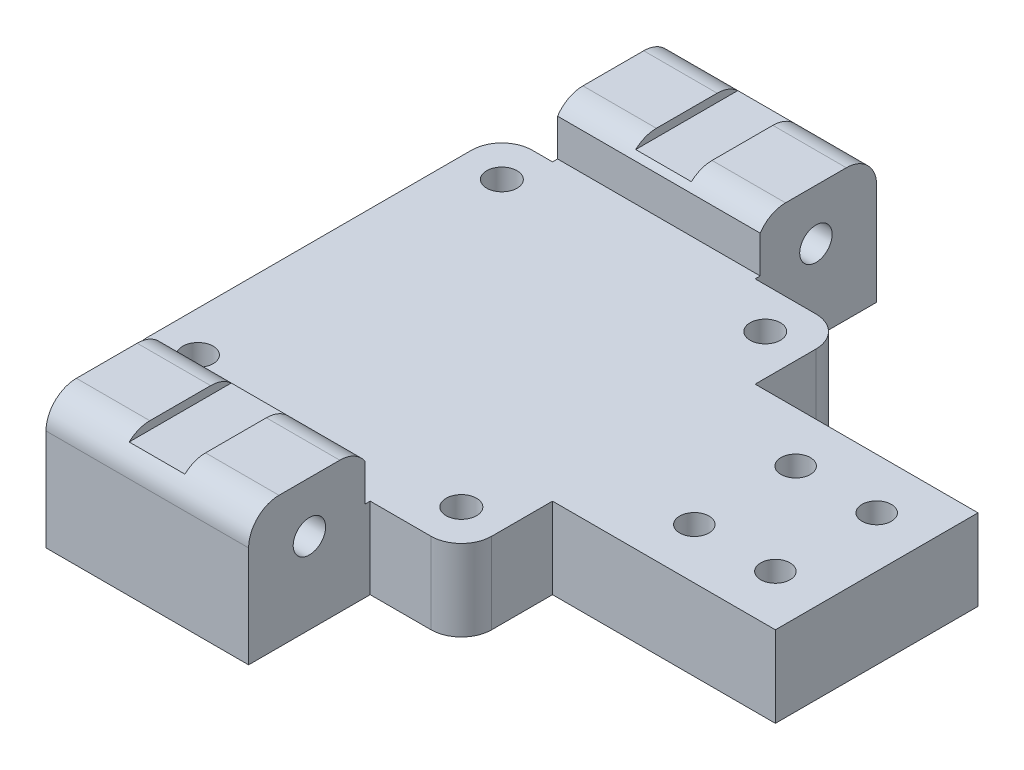
from build123d import *

# Parameters (mm, degrees)
SKETCH1_W            = 300
SKETCH1_H            = 20
BOSS_EXTRUDE1_DEPTH  = 8
SKETCH2_W            = 34
SKETCH2_H            = 8
BOSS_EXTRUDE2_DEPTH  = 9
SKETCH3_W            = 34
SKETCH3_H            = 8
BOSS_EXTRUDE3_DEPTH  = 9
SKETCH4_R            = 1.5
CUT_EXTRUDE1_DEPTH   = 302.504560496
SKETCH5_W            = 25
SKETCH5_H            = 8
BOSS_EXTRUDE4_DEPTH  = 17
SKETCH6_W            = 25
SKETCH6_H            = 8
BOSS_EXTRUDE5_DEPTH  = 17
SKETCH7_W            = 10
SKETCH7_H            = 38
CUT_EXTRUDE2_DEPTH   = 303.37890138
SKETCH8_W            = 7
SKETCH8_H            = 16
CUT_EXTRUDE3_DEPTH   = 4
CUT_EXTRUDE4_DEPTH   = 7
BOSS_EXTRUDE6_DEPTH  = 10
SKETCH12_W           = 8
SKETCH12_H           = 8
BOSS_EXTRUDE7_DEPTH  = 17
SKETCH13_R           = 1.7
CUT_EXTRUDE6_DEPTH   = 305.926220585
SKETCH14_W           = 20
SKETCH14_H           = 13
BOSS_EXTRUDE8_DEPTH  = 12
SKETCH15_R           = 1.6
CUT_EXTRUDE7_DEPTH   = 20
SKETCH16_W           = 20
SKETCH16_H           = 13
BOSS_EXTRUDE9_DEPTH  = 12
SKETCH17_R           = 1.6
CUT_EXTRUDE8_DEPTH   = 20
SKETCH18_W           = 20
SKETCH18_H           = 13
BOSS_EXTRUDE10_DEPTH = 12
CUT_EXTRUDE9_START   = -20
SKETCH19_R           = 1.6
CUT_EXTRUDE9_DEPTH   = 20
SKETCH20_W           = 20
SKETCH20_H           = 13
BOSS_EXTRUDE11_DEPTH = 12
CUT_EXTRUDE10_START  = -20
SKETCH21_R           = 1.6
CUT_EXTRUDE10_DEPTH  = 20
FILLET6_R            = 3
SKETCH22_W           = 123.750788161
SKETCH22_H           = 72.639217631
CUT_EXTRUDE11_DEPTH  = 244
SKETCH23_R           = 1.45
CUT_EXTRUDE12_DEPTH  = 71.611613776
FILLET7_R            = 3
SKETCH24_W           = 5.5
SKETCH24_H           = 78.243551934
CUT_EXTRUDE13_DEPTH  = 0.8
SKETCH25_W           = 20
SKETCH25_H           = 5.75655834
CUT_EXTRUDE14_DEPTH  = 0.5
SKETCH26_W           = 20
SKETCH26_H           = 21.459079842
CUT_EXTRUDE15_DEPTH  = 0.5


with BuildPart() as part:
    # Sketch1 → Boss-Extrude1 (new body)
    with BuildSketch(Plane(origin=(0, 0, 0), x_dir=(1, 0, 0), z_dir=(0, 1, 0))):
        with Locations((150, -10)):
            Rectangle(SKETCH1_W, SKETCH1_H)
    extrude(amount=BOSS_EXTRUDE1_DEPTH)

    # Sketch2 → Boss-Extrude2 (add)
    with BuildSketch(Plane.XY.offset(20)):
        with Locations((17, 4)):
            Rectangle(SKETCH2_W, SKETCH2_H)
        with Locations((283, 4)):
            Rectangle(SKETCH2_W, SKETCH2_H)
    extrude(amount=BOSS_EXTRUDE2_DEPTH)

    # Sketch3 → Boss-Extrude3 (add)
    with BuildSketch(Plane(origin=(0, 0, 0), x_dir=(-1, 0, 0), z_dir=(0, 0, -1))):
        with Locations((-17, 4)):
            Rectangle(SKETCH3_W, SKETCH3_H)
        with Locations((-283, 4)):
            Rectangle(SKETCH3_W, SKETCH3_H)
    extrude(amount=BOSS_EXTRUDE3_DEPTH)

    # Sketch4 → Cut-Extrude1 (cut, through all)
    with BuildSketch(Plane(origin=(0, 8, 0), x_dir=(1, 0, 0), z_dir=(0, 1, 0))):
        with Locations(Location((4, 5, 0), (0, 0, 270))):
            Circle(SKETCH4_R)
        with Locations(Location((30, 5, 0), (0, 0, 270))):
            Circle(SKETCH4_R)
        with Locations(Location((30, -25, 0), (0, 0, 270))):
            Circle(SKETCH4_R)
        with Locations(Location((4, -25, 0), (0, 0, 270))):
            Circle(SKETCH4_R)
        with Locations(Location((296, -25, 0), (0, 0, 270))):
            Circle(SKETCH4_R)
        with Locations(Location((296, 5, 0), (0, 0, 270))):
            Circle(SKETCH4_R)
        with Locations(Location((270, -25, 0), (0, 0, 270))):
            Circle(SKETCH4_R)
        with Locations(Location((270, 5, 0), (0, 0, 270))):
            Circle(SKETCH4_R)
    extrude(amount=-CUT_EXTRUDE1_DEPTH, mode=Mode.SUBTRACT)

    # Sketch5 → Boss-Extrude4 (add)
    with BuildSketch(Plane.XY.offset(20)):
        with Locations((253.5, 4)):
            Rectangle(SKETCH5_W, SKETCH5_H)
    extrude(amount=BOSS_EXTRUDE4_DEPTH)

    # Sketch6 → Boss-Extrude5 (add)
    with BuildSketch(Plane(origin=(0, 0, 0), x_dir=(-1, 0, 0), z_dir=(0, 0, -1))):
        with Locations((-253.5, 4)):
            Rectangle(SKETCH6_W, SKETCH6_H)
    extrude(amount=BOSS_EXTRUDE5_DEPTH)

    # Sketch7 → Cut-Extrude2 (cut, through all)
    with BuildSketch(Plane(origin=(0, 8, 0), x_dir=(1, 0, 0), z_dir=(0, 1, 0))):
        with Locations((254, -10)):
            Rectangle(SKETCH7_W, SKETCH7_H)
    extrude(amount=-CUT_EXTRUDE2_DEPTH, mode=Mode.SUBTRACT)

    # Sketch8 → Cut-Extrude3 (cut)
    with BuildSketch(Plane(origin=(0, 8, 0), x_dir=(1, 0, 0), z_dir=(0, 1, 0))):
        with Locations((262.5, -10)):
            Rectangle(SKETCH8_W, SKETCH8_H)
    extrude(amount=-CUT_EXTRUDE3_DEPTH, mode=Mode.SUBTRACT)

    # Sketch9 → Cut-Extrude4 (cut)
    with BuildSketch(Plane.ZY.offset(-259)):
        Polygon((18, 4), (22, 8), (18, 8), align=None)
        Polygon((2, 4), (-2, 8), (2, 8), align=None)
    extrude(amount=-CUT_EXTRUDE4_DEPTH, mode=Mode.SUBTRACT)

    # Sketch10 → Boss-Extrude6 (add)
    with BuildSketch(Plane.ZY.offset(-259)):
        Polygon((-2, 0), (-9, 8), (-9, 0), align=None)
        Polygon((29, 8), (22, 0), (29, 0), align=None)
    extrude(amount=BOSS_EXTRUDE6_DEPTH)

    # Sketch12 → Boss-Extrude7 (add)
    with BuildSketch(Plane.XY.offset(37)):
        with Locations((245, 4)):
            Rectangle(SKETCH12_W, SKETCH12_H)
    extrude(amount=BOSS_EXTRUDE7_DEPTH)

    # Sketch13 → Cut-Extrude6 (cut, through all)
    with BuildSketch(Plane(origin=(0, 8, 0), x_dir=(1, 0, 0), z_dir=(0, 1, 0))):
        with Locations(Location((245, -50, 0), (0, 0, 270))):
            Circle(SKETCH13_R)
        with Locations(Location((245, -18, 0), (0, 0, 270))):
            Circle(SKETCH13_R)
    extrude(amount=-CUT_EXTRUDE6_DEPTH, mode=Mode.SUBTRACT)

    # Sketch14 → Boss-Extrude8 (add)
    with BuildSketch(Plane.XY.offset(29)):
        with Locations((285, 6.5)):
            Rectangle(SKETCH14_W, SKETCH14_H)
    extrude(amount=BOSS_EXTRUDE8_DEPTH)

    # Sketch15 → Cut-Extrude7 (cut)
    with BuildSketch(Plane(origin=(295, 0, 0), x_dir=(0, 0, -1), z_dir=(1, 0, 0))):
        with Locations((-35, 8)):
            Circle(SKETCH15_R)
    extrude(amount=-CUT_EXTRUDE7_DEPTH, mode=Mode.SUBTRACT)

    # Sketch16 → Boss-Extrude9 (add)
    with BuildSketch(Plane(origin=(0, 0, -9), x_dir=(-1, 0, 0), z_dir=(0, 0, -1))):
        with Locations((-285, 6.5)):
            Rectangle(SKETCH16_W, SKETCH16_H)
    extrude(amount=BOSS_EXTRUDE9_DEPTH)

    # Sketch17 → Cut-Extrude8 (cut)
    with BuildSketch(Plane(origin=(295, 0, 0), x_dir=(0, 0, -1), z_dir=(1, 0, 0))):
        with Locations((15, 8)):
            Circle(SKETCH17_R)
    extrude(amount=-CUT_EXTRUDE8_DEPTH, mode=Mode.SUBTRACT)

    # Sketch18 → Boss-Extrude10 (add)
    with BuildSketch(Plane(origin=(0, 0, -9), x_dir=(-1, 0, 0), z_dir=(0, 0, -1))):
        with Locations((-15, 6.5)):
            Rectangle(SKETCH18_W, SKETCH18_H)
    extrude(amount=BOSS_EXTRUDE10_DEPTH)

    # Sketch19 → Cut-Extrude9 (cut)
    with BuildSketch(Plane.ZY.offset(-5).offset(CUT_EXTRUDE9_START)):
        with Locations(Location((-15, 8, 0), (0, 0, 180))):
            Circle(SKETCH19_R)
    extrude(amount=CUT_EXTRUDE9_DEPTH, mode=Mode.SUBTRACT)

    # Sketch20 → Boss-Extrude11 (add)
    with BuildSketch(Plane.XY.offset(29)):
        with Locations((15, 6.5)):
            Rectangle(SKETCH20_W, SKETCH20_H)
    extrude(amount=BOSS_EXTRUDE11_DEPTH)

    # Sketch21 → Cut-Extrude10 (cut)
    with BuildSketch(Plane.ZY.offset(-5).offset(CUT_EXTRUDE10_START)):
        with Locations(Location((35, 8, 0), (0, 0, 180))):
            Circle(SKETCH21_R)
    extrude(amount=CUT_EXTRUDE10_DEPTH, mode=Mode.SUBTRACT)

    # Fillet6
    fillet6_edges = [part.edges().sort_by_distance(p)[0] for p in [
        (285, 13, 29),
        (285, 13, 41),
        (285, 13, -9),
        (285, 13, -21),
        (15, 13, -9),
        (15, 13, -21),
        (15, 13, 29),
        (15, 13, 41),
    ]]
    fillet(fillet6_edges, radius=FILLET6_R)

    # Sketch22 → Cut-Extrude11 (cut)
    with BuildSketch(Plane(origin=(300, 0, 0), x_dir=(0, 0, -1), z_dir=(1, 0, 0))):
        with Locations((-10.128058827, -1.301866478)):
            Rectangle(SKETCH22_W, SKETCH22_H)
    extrude(amount=-CUT_EXTRUDE11_DEPTH, mode=Mode.SUBTRACT)

    # Sketch23 → Cut-Extrude12 (cut, through all)
    with BuildSketch(Plane(origin=(0, 0, 0), x_dir=(-1, 0, 0), z_dir=(0, -1, 0))):
        with Locations(Location((-51, -5, 0), (0, 0, 90))):
            Circle(SKETCH23_R)
        with Locations(Location((-51, -15, 0), (0, 0, 90))):
            Circle(SKETCH23_R)
        with Locations(Location((-43, -5, 0), (0, 0, 90))):
            Circle(SKETCH23_R)
        with Locations(Location((-43, -15, 0), (0, 0, 90))):
            Circle(SKETCH23_R)
    extrude(amount=-CUT_EXTRUDE12_DEPTH, mode=Mode.SUBTRACT)

    # Fillet7
    fillet7_edges = [part.edges().sort_by_distance(p)[0] for p in [
        (0, 4, 29),
        (34, 4, 29),
        (0, 4, -9),
        (34, 4, -9),
    ]]
    fillet(fillet7_edges, radius=FILLET7_R)

    # Sketch24 → Cut-Extrude13 (cut)
    with BuildSketch(Plane(origin=(0, 13, 0), x_dir=(1, 0, 0), z_dir=(0, 1, 0))):
        with Locations((15, -9.577024089)):
            Rectangle(SKETCH24_W, SKETCH24_H)
    extrude(amount=-CUT_EXTRUDE13_DEPTH, mode=Mode.SUBTRACT)

    # Sketch25 → Cut-Extrude14 (cut)
    with BuildSketch(Plane(origin=(0, 0, 29), x_dir=(-1, 0, 0), z_dir=(0, 0, -1))):
        with Locations((-15, 10.87827917)):
            Rectangle(SKETCH25_W, SKETCH25_H)
    extrude(amount=-CUT_EXTRUDE14_DEPTH, mode=Mode.SUBTRACT)

    # Sketch26 → Cut-Extrude15 (cut)
    with BuildSketch(Plane.XY.offset(-9)):
        with Locations((15, 18.729539921)):
            Rectangle(SKETCH26_W, SKETCH26_H)
    extrude(amount=-CUT_EXTRUDE15_DEPTH, mode=Mode.SUBTRACT)


solid = part.part
